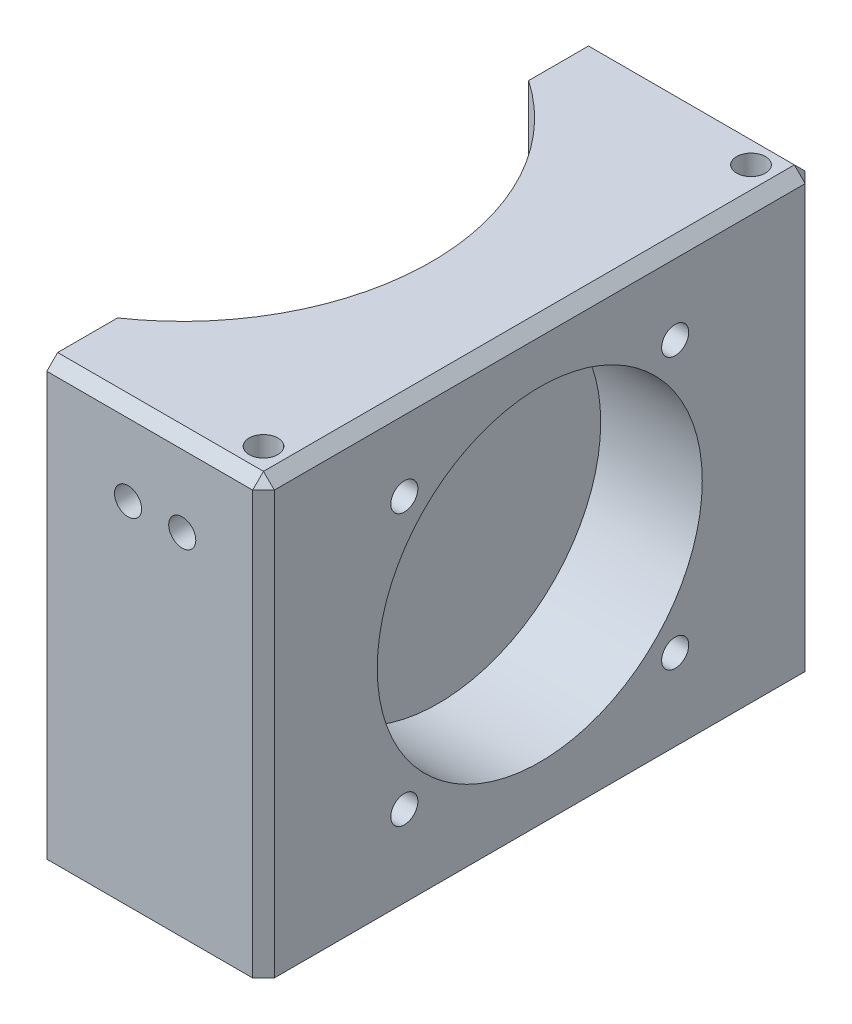
from build123d import *

# Parameters (mm, degrees)
BOSS_EXTRUDE1_DEPTH               = 101.6
SKETCH2_R                         = 38.1
CUT_EXTRUDE2_DEPTH                = 23.8125
F_1_4_20_TAPPED_HOLE1_D           = 5.1054
F_1_4_20_TAPPED_HOLE1_DEPTH       = 19.05
F_1_4_20_TAPPED_HOLE1_CBORE_D     = 6.35
F_1_4_20_TAPPED_HOLE1_CBORE_DEPTH = 12.7
F_1_4_20_TAPPED_HOLE1_TIP         = 1.533816902
H_0_266_DIAMETER_HOLE1_D          = 6.7564
F_1_4_20_TAPPED_HOLE2_AT_2_COUNT  = 2
F_1_4_20_TAPPED_HOLE2_AT_2_PITCH  = 12.7
CHAMFER1_SIZE                     = 2.54


with BuildPart() as part:
    # Sketch1 → Boss-Extrude1 (new body)
    with BuildSketch(Plane(origin=(0, 0, 0), x_dir=(1, 0, 0), z_dir=(0, 1, 0))):
        with BuildLine():
            Line((33.02, 64.77), (33.02, 48.193111541))
            ThreePointArc((33.02, 48.193111541), (58.42, 0), (33.02, -48.193111541))
            Line((33.02, -48.193111541), (33.02, -64.77))
            Line((33.02, -64.77), (83.82, -64.77))
            Line((83.82, -64.77), (83.82, 64.77))
            Line((83.82, 64.77), (33.02, 64.77))
        make_face()
    extrude(amount=BOSS_EXTRUDE1_DEPTH)

    # Sketch2 → Cut-Extrude2 (cut)
    with BuildSketch(Plane(origin=(83.82, 0, 0), x_dir=(0, 0, -1), z_dir=(1, 0, 0))):
        with Locations((0, 50.8)):
            Circle(SKETCH2_R)
    extrude(amount=-CUT_EXTRUDE2_DEPTH, mode=Mode.SUBTRACT)

    # 1/4-20 Tapped Hole1
    with Locations(Plane(origin=(83.82, 0, 0), x_dir=(0, 0, -1), z_dir=(1, 0, 0))):
        with Locations((-31.75, 82.55), (31.75, 82.55), (31.75, 19.05), (-31.75, 19.05)):
            CounterBoreHole(F_1_4_20_TAPPED_HOLE1_D / 2, F_1_4_20_TAPPED_HOLE1_CBORE_D / 2, F_1_4_20_TAPPED_HOLE1_CBORE_DEPTH, depth=F_1_4_20_TAPPED_HOLE1_DEPTH)
            with Locations((0, 0, -(F_1_4_20_TAPPED_HOLE1_DEPTH + F_1_4_20_TAPPED_HOLE1_TIP / 2))):  # 118° drill point
                Cone(0, F_1_4_20_TAPPED_HOLE1_D / 2, F_1_4_20_TAPPED_HOLE1_TIP, mode=Mode.SUBTRACT)

    # H (0.266) Diameter Hole1 (through all)
    with Locations(Plane(origin=(0, 101.6, 0), x_dir=(-1, 0, 0), z_dir=(0, 1, 0))):
        with Locations((76.2, -57.15), (76.2, 57.15), (-76.2, 57.15), (-76.2, -57.15)):
            Hole(H_0_266_DIAMETER_HOLE1_D / 2)

    # Sketch11 → 1/4-20 Tapped Hole2 (revolve, cut)
    with BuildSketch(Plane(origin=(64.77, 82.20380383, 64.77), x_dir=(0, -1, 0), z_dir=(1, 0, 0))):
        Polygon((0, 0), (0, 20.583816902), (2.5527, 19.05), (2.5527, 12.7), (3.175, 12.7), (3.175, 0), align=None)
    f_1_4_20_tapped_hole2 = revolve(axis=Axis((64.77, 82.20380383, 71.12), (0, 0, -1)), mode=Mode.SUBTRACT)

    # 1/4-20 Tapped Hole2 at 2: 1/4-20 Tapped Hole2 ×2
    with Locations(*[(-i * F_1_4_20_TAPPED_HOLE2_AT_2_PITCH, 0, 0) for i in range(1, F_1_4_20_TAPPED_HOLE2_AT_2_COUNT)]):
        add(f_1_4_20_tapped_hole2, mode=Mode.SUBTRACT)

    # Mirror1: 1/4-20 Tapped Hole2 across plane
    add(f_1_4_20_tapped_hole2.mirror(Plane.XY), mode=Mode.SUBTRACT)

    # Mirror1 copy 1 sketch → Mirror1 copy 1 (revolve, cut)
    with BuildSketch(Plane(origin=(52.07, 82.20380383, -64.77), x_dir=(0, -1, 0), z_dir=(1, 0, 0))):
        Polygon((0, 0), (0, -20.583816902), (2.5527, -19.05), (2.5527, -12.7), (3.175, -12.7), (3.175, 0), align=None)
    revolve(axis=Axis((52.07, 82.20380383, -71.12), (0, 0, -1)), mode=Mode.SUBTRACT)

    # Chamfer1
    chamfer1_edges = [part.edges().sort_by_distance(p)[0] for p in [
        (83.82, 50.8, 64.77),
        (83.82, 50.8, -64.77),
        (58.42, 101.6, 64.77),
        (83.82, 101.6, 0),
        (58.42, 101.6, -64.77),
    ]]
    chamfer(chamfer1_edges, length=CHAMFER1_SIZE)


solid = part.part
